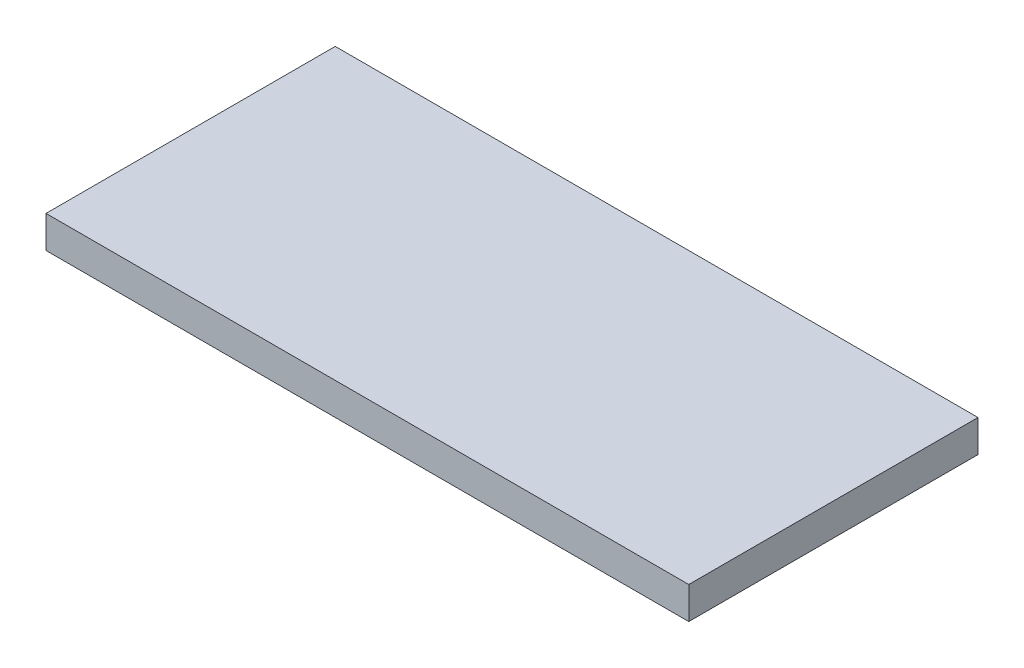
from build123d import *

# Parameters (mm, degrees)
SKETCH_1_W      = 100
SKETCH_1_H      = 45
EXTRUDE_1_DEPTH = 5


with BuildPart() as part:
    # 草图1 → 凸台-拉伸1 (new body)
    with BuildSketch(Plane(origin=(0, 0, 0), x_dir=(1, 0, 0), z_dir=(0, 1, 0))):
        Rectangle(SKETCH_1_W, SKETCH_1_H)
    extrude(amount=EXTRUDE_1_DEPTH)


solid = part.part
